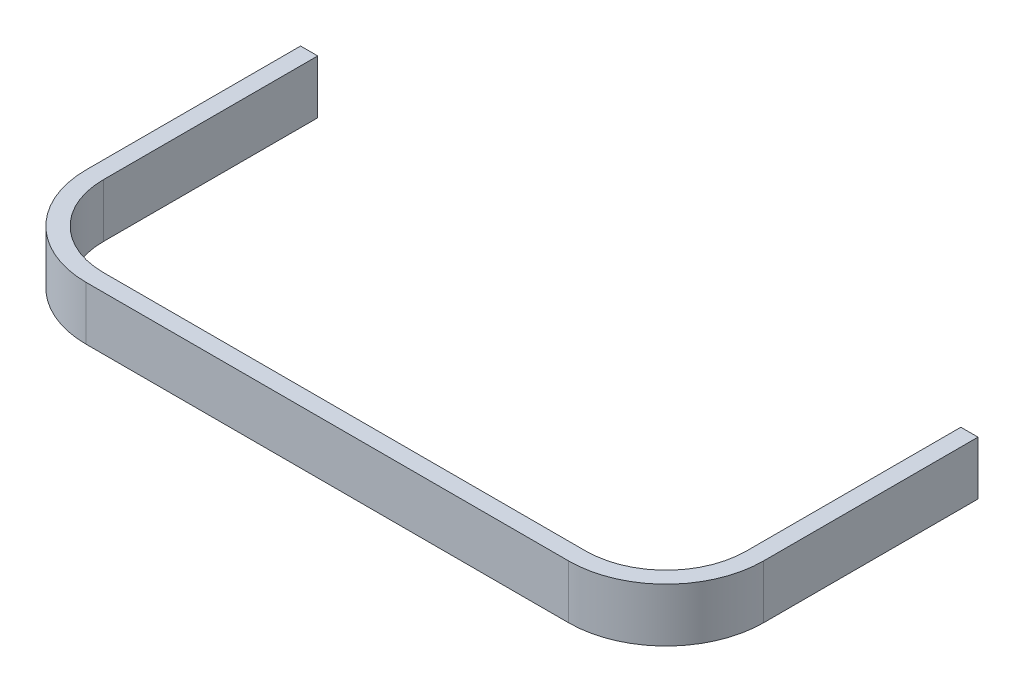
from build123d import *

# Parameters (mm, degrees)
BOSS_EXTRUDE4_DEPTH = 12.7


with BuildPart() as part:
    # Sketch474 → Boss-Extrude4 (new body)
    with BuildSketch(Plane(origin=(0, 0, 0), x_dir=(1, 0, 0), z_dir=(0, 1, 0))):
        with BuildLine():
            Line((-76.2, 0), (-76.2, -50.8))
            ThreePointArc((-76.2, -50.8), (-70.620384182, -64.270384182), (-57.15, -69.85))
            Line((-57.15, -69.85), (57.15, -69.85))
            ThreePointArc((57.15, -69.85), (70.620384182, -64.270384182), (76.2, -50.8))
            Line((76.2, -50.8), (76.2, 0))
            Line((76.2, 0), (80.264, 0))
            Line((80.264, 0), (80.264, -50.8))
            ThreePointArc((80.264, -50.8), (73.49406614, -67.14406614), (57.15, -73.914))
            Line((57.15, -73.914), (-57.15, -73.914))
            ThreePointArc((-57.15, -73.914), (-73.49406614, -67.14406614), (-80.264, -50.8))
            Line((-80.264, -50.8), (-80.264, 0))
            Line((-80.264, 0), (-76.2, 0))
        make_face()
    extrude(amount=BOSS_EXTRUDE4_DEPTH)


solid = part.part
